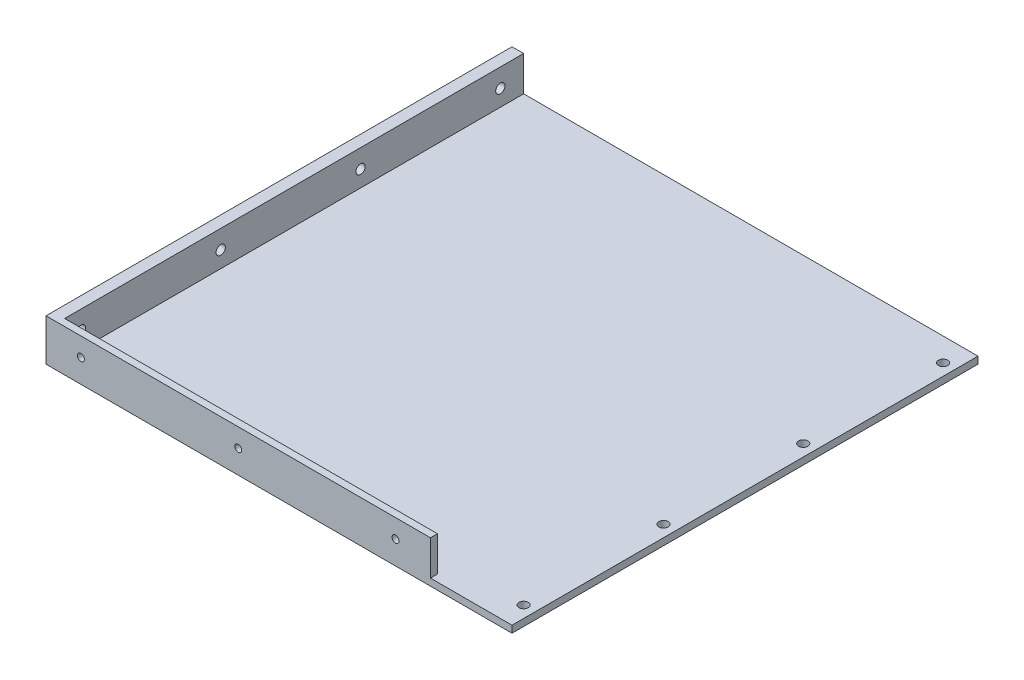
from build123d import *

# Parameters (mm, degrees)
SKETCH1_W           = 200
SKETCH1_H           = 200
BOSS_EXTRUDE1_DEPTH = 3
SKETCH2_W           = 5
SKETCH2_H           = 200
BOSS_EXTRUDE2_DEPTH = 15
CUT_EXTRUDE1_REACH  = 226.33
SKETCH3_R           = 2
LPATTERN1_COUNT     = 4
LPATTERN1_PITCH     = 60
CUT_EXTRUDE2_REACH  = 144.215
SKETCH4_R           = 2
LPATTERN2_COUNT     = 4
LPATTERN2_PITCH     = 60
SKETCH5_W           = 160
SKETCH5_H           = 3
BOSS_EXTRUDE3_DEPTH = 15
CUT_EXTRUDE3_REACH  = 226.33
SKETCH6_R           = 1.5


with BuildPart() as part:
    # Sketch1 → Boss-Extrude1 (new body)
    with BuildSketch(Plane(origin=(0, 0, 0), x_dir=(1, 0, 0), z_dir=(0, 1, 0))):
        Rectangle(SKETCH1_W, SKETCH1_H)
    extrude(amount=BOSS_EXTRUDE1_DEPTH)

    # Sketch2 → Boss-Extrude2 (add)
    with BuildSketch(Plane(origin=(0, 3, 0), x_dir=(1, 0, 0), z_dir=(0, 1, 0))):
        with Locations((-97.5, 0)):
            Rectangle(SKETCH2_W, SKETCH2_H)
    extrude(amount=BOSS_EXTRUDE2_DEPTH)

    # Sketch3 → Cut-Extrude1 (cut, up to next)
    with BuildSketch(Plane.ZY.offset(100), mode=Mode.PRIVATE) as cut_extrude1_sk1:
        with Locations((90, 10)):
            Circle(SKETCH3_R)
    cut_extrude1_tool1 = extrude(cut_extrude1_sk1.sketch, amount=-CUT_EXTRUDE1_REACH, mode=Mode.PRIVATE) & part.part
    cut_extrude1 = cut_extrude1_tool1.solids().sort_by_distance((-100, 10, 90))[0]
    add(cut_extrude1, mode=Mode.SUBTRACT)

    # LPattern1: Cut-Extrude1 ×4
    with Locations(*[(0, 0, -i * LPATTERN1_PITCH) for i in range(1, LPATTERN1_COUNT)]):
        add(cut_extrude1, mode=Mode.SUBTRACT)

    # Sketch4 → Cut-Extrude2 (cut, up to next)
    with BuildSketch(Plane(origin=(0, 3, 0), x_dir=(1, 0, 0), z_dir=(0, 1, 0)), mode=Mode.PRIVATE) as cut_extrude2_sk1:
        with Locations(Location((95, 90, 0), (0, 0, 270))):
            Circle(SKETCH4_R)
    cut_extrude2_tool1 = extrude(cut_extrude2_sk1.sketch, amount=-CUT_EXTRUDE2_REACH, mode=Mode.PRIVATE) & part.part
    cut_extrude2 = cut_extrude2_tool1.solids().sort_by_distance((95, 3, -90))[0]
    add(cut_extrude2, mode=Mode.SUBTRACT)

    # LPattern2: Cut-Extrude2 ×4
    with Locations(*[(0, 0, i * LPATTERN2_PITCH) for i in range(1, LPATTERN2_COUNT)]):
        add(cut_extrude2, mode=Mode.SUBTRACT)

    # Sketch5 → Boss-Extrude3 (add)
    with BuildSketch(Plane(origin=(0, 3, 0), x_dir=(1, 0, 0), z_dir=(0, 1, 0))):
        with Locations((-15, -98.5)):
            Rectangle(SKETCH5_W, SKETCH5_H)
    extrude(amount=BOSS_EXTRUDE3_DEPTH)

    # Sketch6 → Cut-Extrude3 (cut, up to next)
    with BuildSketch(Plane.XY.offset(100), mode=Mode.PRIVATE) as cut_extrude3_sk1:
        with Locations((-85, 10)):
            Circle(SKETCH6_R)
    cut_extrude3_tool1 = extrude(cut_extrude3_sk1.sketch, amount=-CUT_EXTRUDE3_REACH, mode=Mode.PRIVATE) & part.part
    # Sketch6 → Cut-Extrude3 (cut, up to next)
    with BuildSketch(Plane.XY.offset(100), mode=Mode.PRIVATE) as cut_extrude3_sk2:
        with Locations((-17.5, 10)):
            Circle(SKETCH6_R)
    cut_extrude3_tool2 = extrude(cut_extrude3_sk2.sketch, amount=-CUT_EXTRUDE3_REACH, mode=Mode.PRIVATE) & part.part
    # Sketch6 → Cut-Extrude3 (cut, up to next)
    with BuildSketch(Plane.XY.offset(100), mode=Mode.PRIVATE) as cut_extrude3_sk3:
        with Locations((50, 10)):
            Circle(SKETCH6_R)
    cut_extrude3_tool3 = extrude(cut_extrude3_sk3.sketch, amount=-CUT_EXTRUDE3_REACH, mode=Mode.PRIVATE) & part.part
    add(cut_extrude3_tool1.solids().sort_by_distance((-85, 10, 100))[0], mode=Mode.SUBTRACT)
    add(cut_extrude3_tool2.solids().sort_by_distance((-17.5, 10, 100))[0], mode=Mode.SUBTRACT)
    add(cut_extrude3_tool3.solids().sort_by_distance((50, 10, 100))[0], mode=Mode.SUBTRACT)


solid = part.part
